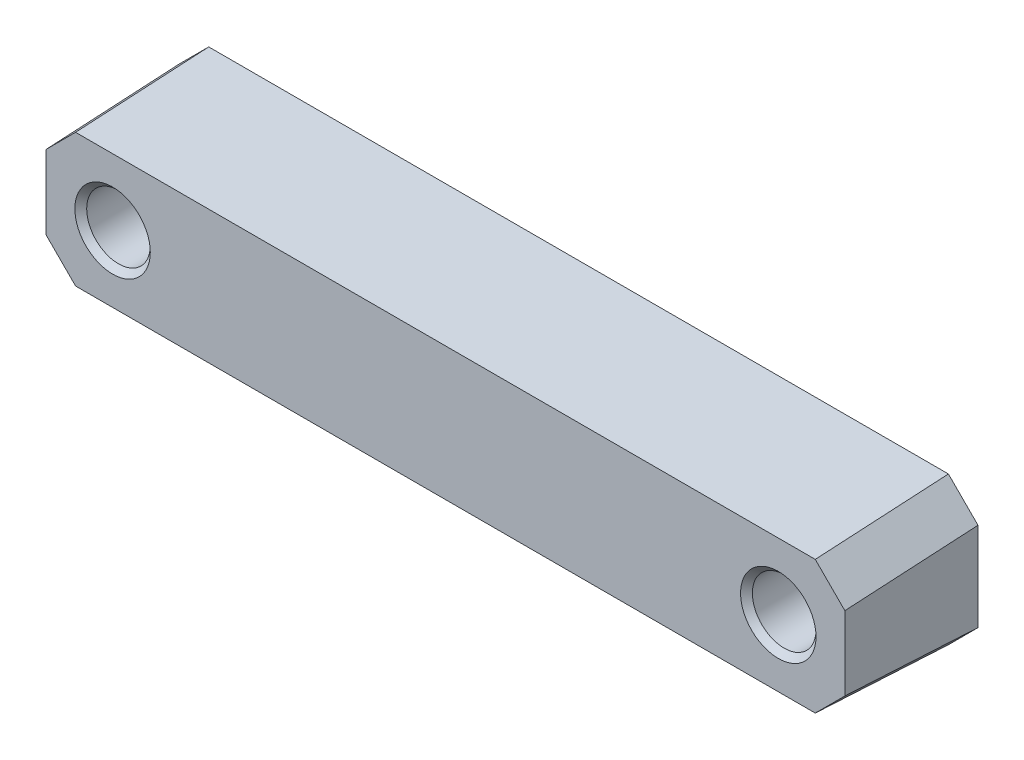
from build123d import *

# Parameters (mm, degrees)
SKETCH3_R          = 2.15
CUT_EXTRUDE1_DEPTH = 10
CHAMFER1_SIZE      = 0.4
CHAMFER2_SIZE      = 2
CHAMFER3_SIZE      = 2


with BuildPart() as part:
    # Sketch1 → Loft1 section 0
    with BuildSketch(Plane.XY):
        with BuildLine():
            Line((0, 0), (54, 0))
            Line((54, 0), (54, 10))
            Line((54, 10), (0, 10))
            Line((0, 10), (0, 0))
        make_face()
    # Sketch2 → Loft1 section 1
    with BuildSketch(Plane.XY.offset(9)):
        with BuildLine():
            Line((0, 9.5), (54, 9.5))
            Line((54, 9.5), (54, 0.5))
            Line((54, 0.5), (0, 0.5))
            Line((0, 0.5), (0, 9.5))
        make_face()
    loft()

    # Sketch3 → Cut-Extrude1 (cut)
    with BuildSketch(Plane(origin=(0, 0, 0), x_dir=(-1, 0, 0), z_dir=(0, 0, -1))):
        with Locations((-49.5, 5)):
            Circle(SKETCH3_R)
        with Locations((-4.5, 5)):
            Circle(SKETCH3_R)
    extrude(amount=-CUT_EXTRUDE1_DEPTH, mode=Mode.SUBTRACT)

    # Chamfer1
    chamfer1_edges = [part.edges().sort_by_distance(p)[0] for p in [
        (51.65, 5, 9),
        (51.65, 5, 0),
        (6.65, 5, 9),
        (6.65, 5, 0),
    ]]
    chamfer(chamfer1_edges, length=CHAMFER1_SIZE)

    # Chamfer2
    chamfer2_edges = [part.edges().sort_by_distance(p)[0] for p in [
        (0, 9.75, 4.5),
        (54, 9.75, 4.5),
    ]]
    chamfer(chamfer2_edges, length=CHAMFER2_SIZE)

    # Chamfer3
    chamfer3_edges = [part.edges().sort_by_distance(p)[0] for p in [
        (54, 0.25, 4.5),
        (0, 0.25, 4.5),
    ]]
    chamfer(chamfer3_edges, length=CHAMFER3_SIZE)


solid = part.part
